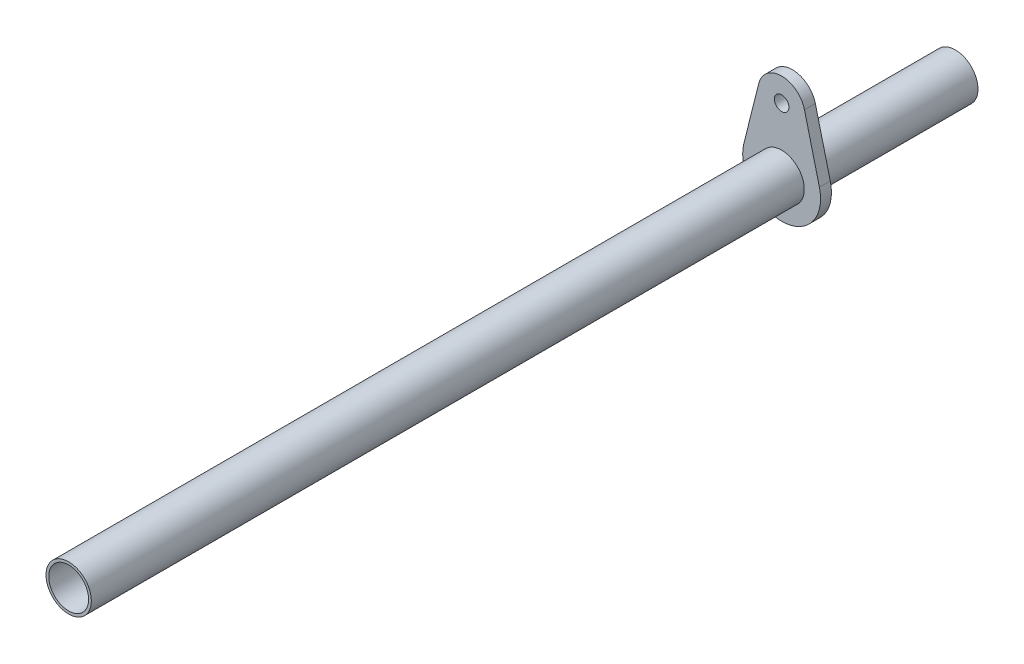
from build123d import *

# Parameters (mm, degrees)
SKETCH1_R           = 12.525
SKETCH1_R_2         = 11.025
EXTRUDE_THIN1_DEPTH = 490
BOSS_EXTRUDE2_START = 90
SKETCH1_4_R         = 12.525
SKETCH1_4_R_2       = 4.025
BOSS_EXTRUDE2_DEPTH = 6


with BuildPart() as part:
    # Sketch1 → Extrude-Thin1 (new body)
    with BuildSketch(Plane.XY):
        Circle(SKETCH1_R)
        Circle(SKETCH1_R_2, mode=Mode.SUBTRACT)
    extrude(amount=EXTRUDE_THIN1_DEPTH)

    # Sketch1<4> → Boss-Extrude2 (add)
    with BuildSketch(Plane.XY.offset(BOSS_EXTRUDE2_START)):
        with BuildLine():
            Line((-20.880585929, 5.2275), (-12.635058385, 38.163214286))
            ThreePointArc((-12.635058385, 38.163214286), (0, 48.025), (12.635058385, 38.163214286))
            Line((12.635058385, 38.163214286), (20.880585929, 5.2275))
            ThreePointArc((20.880585929, 5.2275), (0, -21.525), (-20.880585929, 5.2275))
        make_face()
        Circle(SKETCH1_4_R, mode=Mode.SUBTRACT)
        with Locations((0, 35)):
            Circle(SKETCH1_4_R_2, mode=Mode.SUBTRACT)
    extrude(amount=BOSS_EXTRUDE2_DEPTH)


solid = part.part
